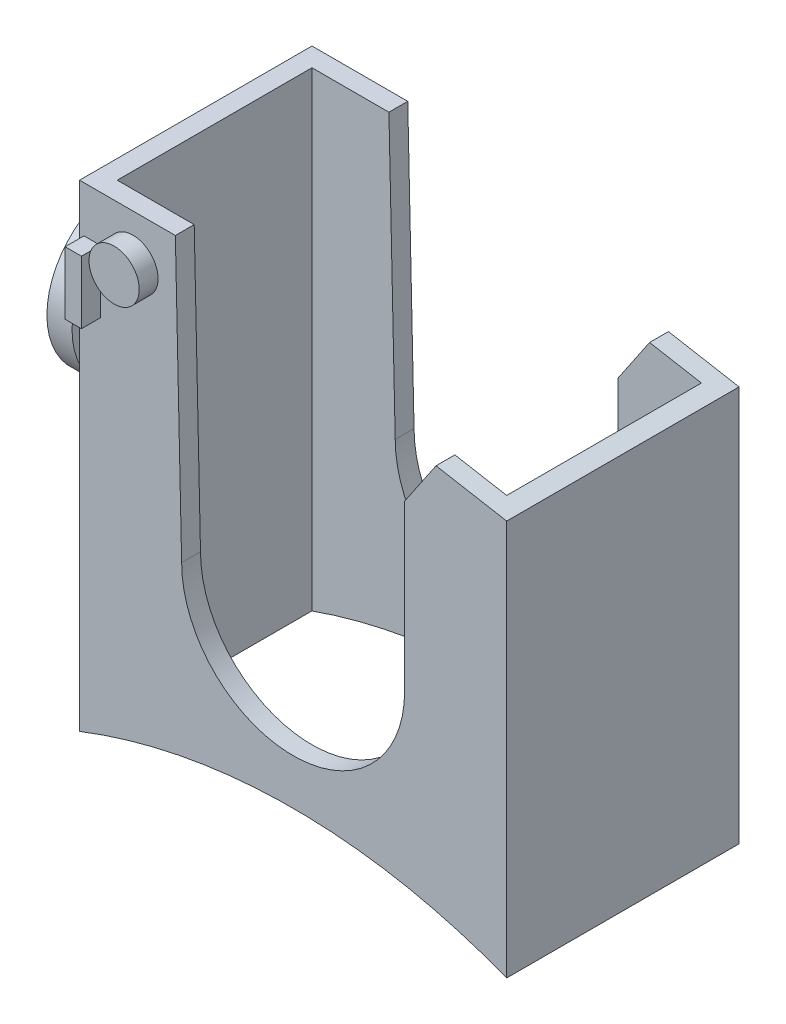
from build123d import *

# Parameters (mm, degrees)
SALIENTE_EXTRUIR1_DEPTH = 18.5
CORTAR_EXTRUIR1_DEPTH   = 53.5
CROQUIS4_R              = 4
CROQUIS4_W              = 2.6
CROQUIS4_H              = 10
SALIENTE_EXTRUIR3_DEPTH = 3


with BuildPart() as part:
    # Croquis1 → Saliente-Extruir1 (new, symmetric)
    with BuildSketch(Plane.XY):
        with BuildLine():
            Line((-34, 44.6), (-34, -31.4))
            ThreePointArc((-34, -31.4), (0, -25), (34, -31.4))
            Line((34, -31.4), (34, 31.6))
            Line((34, 31.6), (22.75, 33.6))
            Line((22.75, 33.6), (17.75, 26.215384615))
            Line((17.75, 26.215384615), (17.75, 0))
            ThreePointArc((17.75, 0), (0, -17.75), (-17.75, 0))
            Line((-17.75, 0), (-18.75, 44.6))
            Line((-18.75, 44.6), (-34, 44.6))
        make_face()
    extrude(amount=SALIENTE_EXTRUIR1_DEPTH, both=True)

    # Croquis2 → Cortar-Extruir1 (cut, symmetric)
    with BuildSketch(Plane(origin=(0, 0, 0), x_dir=(1, 0, 0), z_dir=(0, 1, 0))):
        Polygon((-18.75, -15.5), (-31, -15.5), (-31, 15.5), (-18.75, 15.5), (-17.75, 15.5), (17.75, 15.5), (22.75, 15.5), (31, 15.5), (31, -15.5), (22.75, -15.5), (17.75, -15.5), (-17.75, -15.5), align=None)
    extrude(amount=CORTAR_EXTRUIR1_DEPTH, both=True, mode=Mode.SUBTRACT)

    # Croquis3 → Revolución1 (revolve)
    with BuildSketch(Plane.XY, mode=Mode.PRIVATE) as revoluci_n1_sk:
        Polygon((-34, 17.6), (-34, 3.6), (-37, 3.6), (-37, 10.3), (-41, 10.3), (-41, 4.9), (-45, 4.9), (-45, 17.6), align=None)
    revolve(revoluci_n1_sk.sketch.rotate(Axis((19.47822933, 17.6, 0), (-1, 0, 0)), 180), axis=Axis((19.47822933, 17.6, 0), (-1, 0, 0)))

    # Croquis4 → Saliente-Extruir3 (add)
    with BuildSketch(Plane.XY.offset(18.5)):
        with Locations((-25.5, 37.27)):
            Circle(CROQUIS4_R)
        with Locations((-32, 32.27)):
            Rectangle(CROQUIS4_W, CROQUIS4_H)
    extrude(amount=SALIENTE_EXTRUIR3_DEPTH)


solid = part.part
